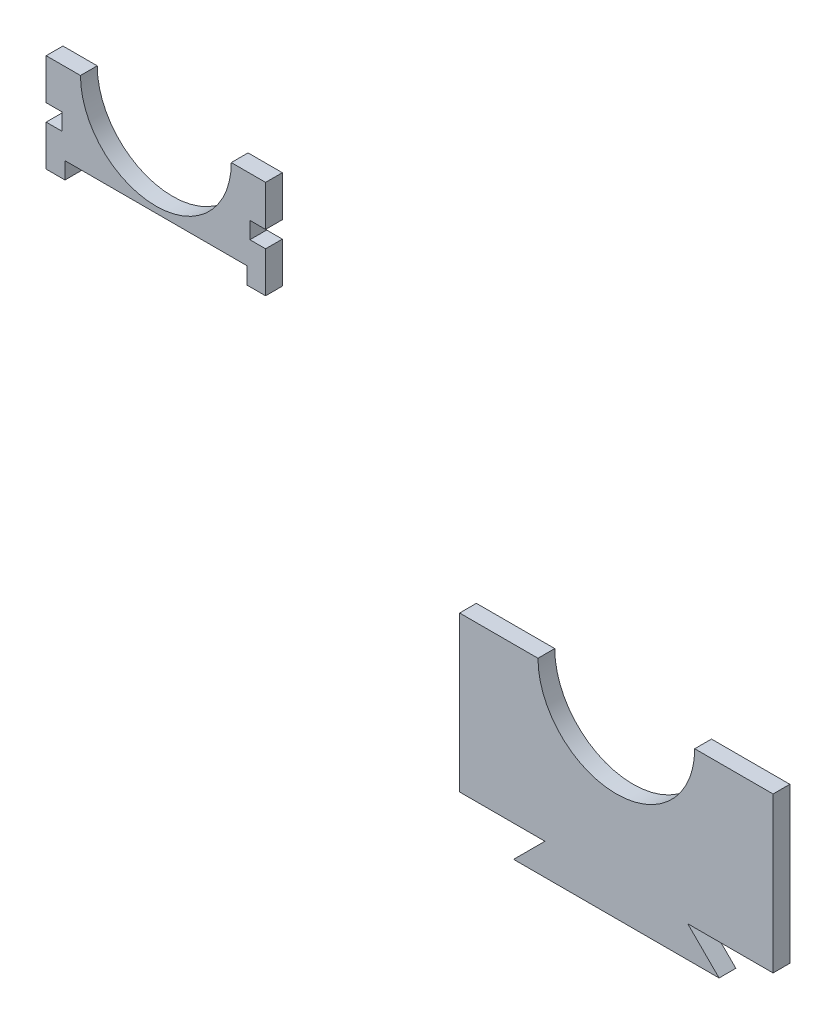
from build123d import *

# Parameters (mm, degrees)
BOSS_EXTRUDE1_DEPTH   = 5.35
BOSS_EXTRUDE1_2_DEPTH = 5.35


with BuildPart() as part:
    # Model → Boss-Extrude1 (new body)
    with BuildSketch(Plane.XY):
        with BuildLine():
            Line((-35, 13), (-35, 26))
            Line((-35, 26), (-24.055, 26))
            ThreePointArc((-24.055, 26), (0, 1.945), (24.055, 26))
            Line((24.055, 26), (35, 26))
            Line((35, 26), (35, 13))
            Line((35, 13), (30, 13))
            Line((30, 13), (30, 7.65))
            Line((30, 7.65), (35, 7.65))
            Line((35, 7.65), (35, -5.317542305))
            Line((35, -5.317542305), (35, -5.35))
            Line((35, -5.35), (29, -5.35))
            Line((29, -5.35), (29, 0))
            Line((29, 0), (-29, 0))
            Line((-29, 0), (-29, -5.35))
            Line((-29, -5.35), (-35, -5.35))
            Line((-35, -5.35), (-35, -5.317542305))
            Line((-35, -5.317542305), (-35, 7.65))
            Line((-35, 7.65), (-30, 7.65))
            Line((-30, 7.65), (-30, 13))
            Line((-30, 13), (-35, 13))
        make_face()
    extrude(amount=BOSS_EXTRUDE1_DEPTH)


with BuildPart() as body_2:
    # Model → Boss-Extrude1 2 (new body)
    with BuildSketch(Plane.XY):
        with BuildLine():
            Line((96.897147823, -111.477215278), (124.119509819, -111.477215278))
            Line((124.119509819, -111.477215278), (114.119509819, -121.477215278))
            Line((114.119509819, -121.477215278), (179.674785827, -121.477215278))
            Line((179.674785827, -121.477215278), (169.674785827, -111.477215278))
            Line((169.674785827, -111.477215278), (196.897147823, -111.477215278))
            Line((196.897147823, -111.477215278), (196.897147823, -62.02269271))
            Line((196.897147823, -62.02269271), (171.897147823, -62.02269271))
            ThreePointArc((171.897147823, -62.02269271), (146.897147823, -87.02269271), (121.897147823, -62.02269271))
            Line((121.897147823, -62.02269271), (96.897147823, -62.02269271))
            Line((96.897147823, -62.02269271), (96.897147823, -111.477215278))
        make_face()
    extrude(amount=BOSS_EXTRUDE1_2_DEPTH)


solid = Compound([part.part, body_2.part])
